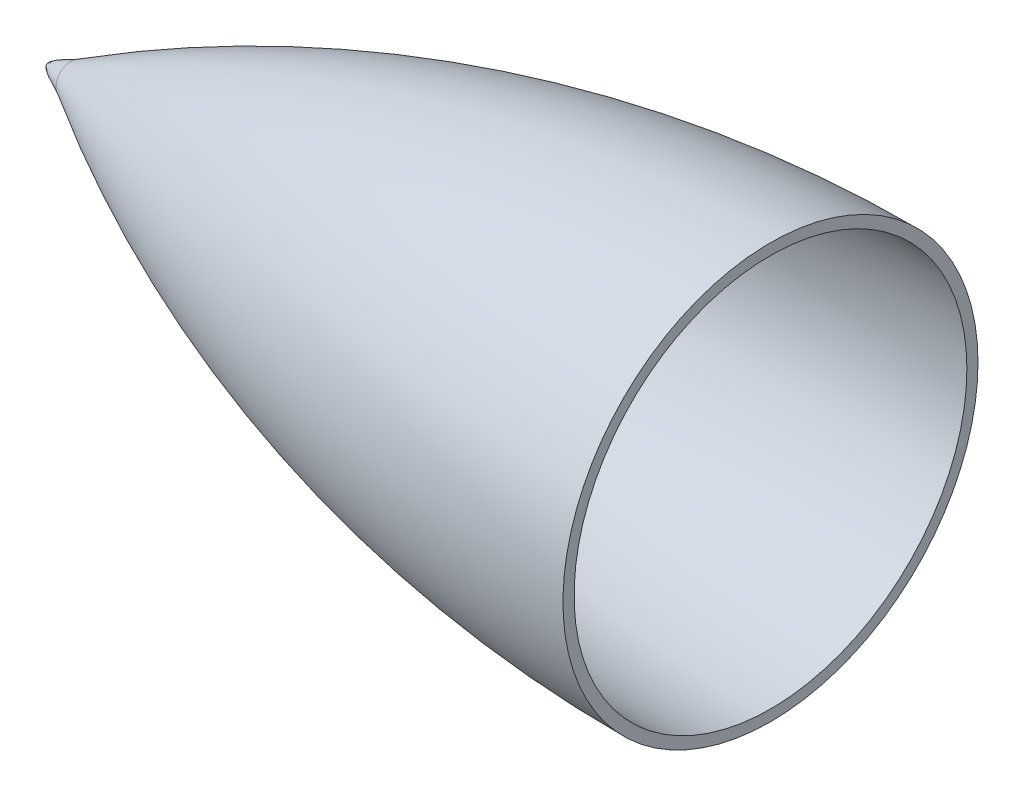
from build123d import *


with BuildPart() as part:
    # Sketch1 → Revolve1 (revolve)
    with BuildSketch(Plane.XY, mode=Mode.PRIVATE) as revolve1_sk:
        with BuildLine():
            ThreePointArc((0, 283.127906977), (-78.020830552, 272.165687972), (-150, 240.127906977))
            Line((-150, 240.127906977), (-140.334318434, 240.127906977))
            ThreePointArc((-140.334318434, 240.127906977), (-135.892976509, 242.668975303), (-131.405638617, 245.127906977))
            ThreePointArc((-131.405638617, 245.127906977), (-103.824897521, 258.022330999), (-75, 267.824817071))
            Line((-75, 267.824817071), (-75, 270.627628554))
            ThreePointArc((-75, 270.627628554), (-37.845229818, 278.266153021), (0, 280.827906977))
            Line((0, 280.827906977), (0, 283.127906977))
        make_face()
    revolve(revolve1_sk.sketch.rotate(Axis((-150, 240.127906977, 0), (-1, 0, 0)), 90), axis=Axis((-150, 240.127906977, 0), (-1, 0, 0)))

    # Sketch2 → Cut-Revolve1 (revolve, cut)
    with BuildSketch(Plane.XY, mode=Mode.PRIVATE) as cut_revolve1_sk:
        with BuildLine():
            Line((-150, 240.127906977), (-145, 240.127906977))
            Line((-145, 240.127906977), (-145, 243.17979297))
            ThreePointArc((-145, 243.17979297), (-147.507893016, 241.666781348), (-150, 240.127906977))
        make_face()
    revolve(cut_revolve1_sk.sketch.rotate(Axis((-150, 240.127906977, 0), (1, 0, 0)), 180), axis=Axis((-150, 240.127906977, 0), (1, 0, 0)), mode=Mode.SUBTRACT)

    # Sketch4 → Revolve2 (revolve)
    with BuildSketch(Plane.XY, mode=Mode.PRIVATE) as revolve2_sk:
        with BuildLine():
            Line((-145, 240.127906977), (-150, 240.127906977))
            add(Edge.make_bspline(
                [(-150, 240.127906977), (-149.571591748, 241.095083065), (-147.476516829, 242.062259153), (-145, 243.17979297)],
                knots=[0.5, 0.5, 0.5, 0.5, 1, 1, 1, 1], degree=3))
            Line((-145, 243.17979297), (-145, 240.127906977))
        make_face()
    revolve(revolve2_sk.sketch.rotate(Axis((-145, 240.127906977, 0), (-1, 0, 0)), 180), axis=Axis((-145, 240.127906977, 0), (-1, 0, 0)))


solid = part.part
